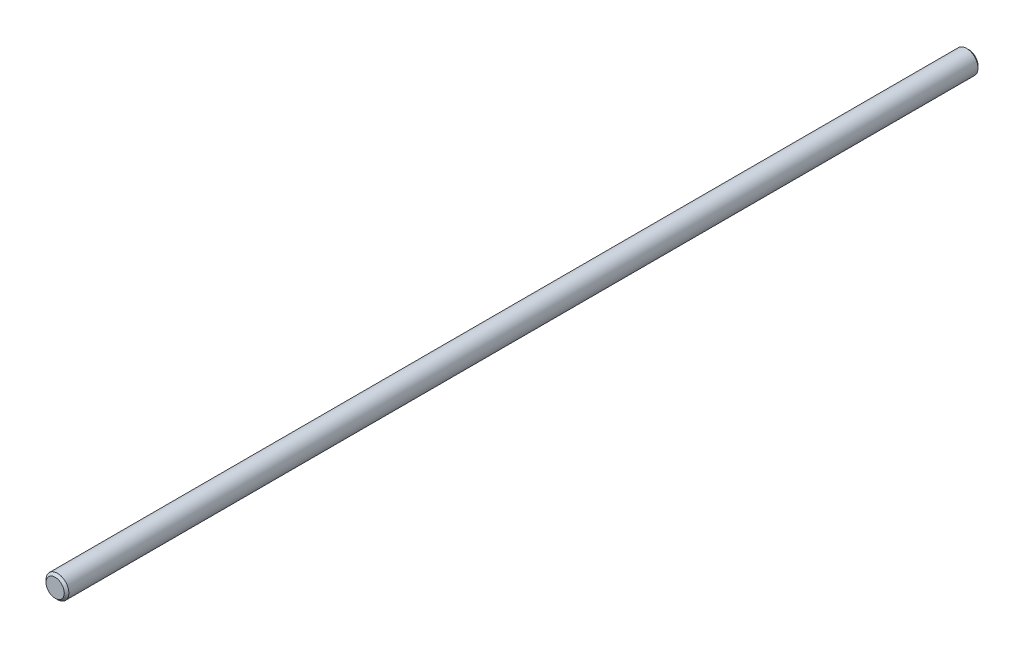
from build123d import *

# Parameters (mm, degrees)
SKETCH3_R           = 1.5875
BOSS_EXTRUDE1_DEPTH = 63.5
CHAMFER1_SIZE       = 0.3175


with BuildPart() as part:
    # Sketch3 → Boss-Extrude1 (new, symmetric)
    with BuildSketch(Plane.XY):
        Circle(SKETCH3_R)
    extrude(amount=BOSS_EXTRUDE1_DEPTH, both=True)

    # Chamfer1
    chamfer1_edges = [part.edges().sort_by_distance(p)[0] for p in [
        (-1.5875, 0, -63.5),
        (-1.5875, 0, 63.5),
    ]]
    chamfer(chamfer1_edges, length=CHAMFER1_SIZE)


solid = part.part
